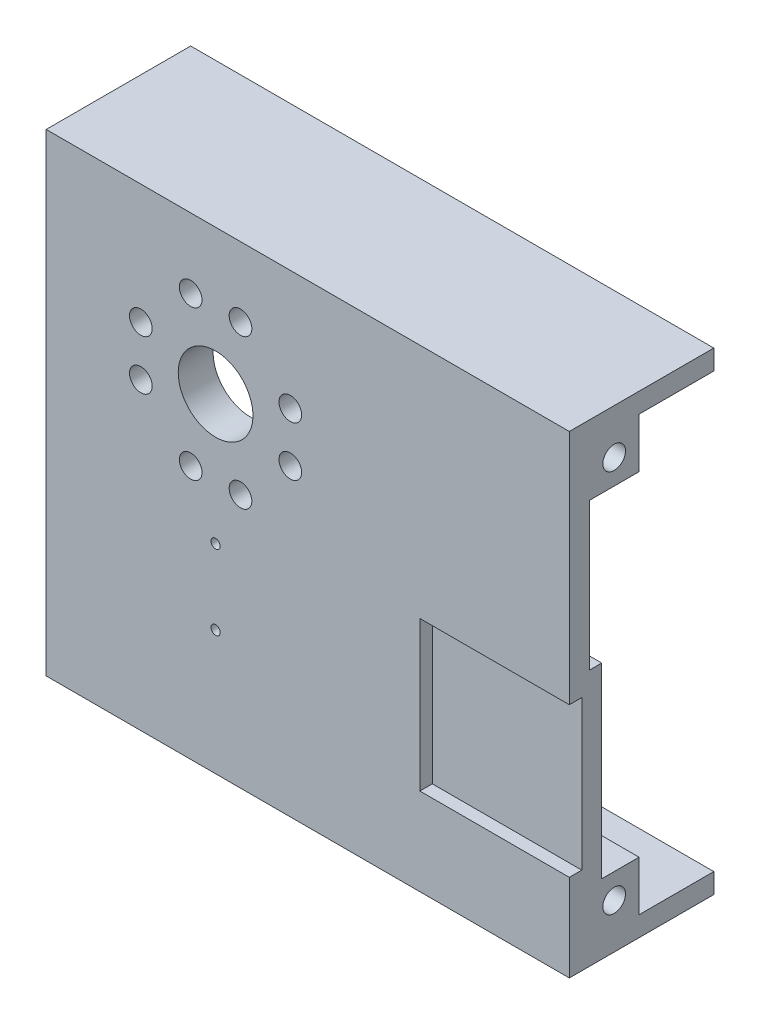
from build123d import *

# Parameters (mm, degrees)
SKETCH_1_W               = 210
SKETCH_1_H               = 190
EXTRUDE_1_DEPTH          = 8
EXTRUDE_2_DEPTH          = 50
SKETCH_3_W               = 20
SKETCH_3_H               = 20
EXTRUDE_3_DEPTH          = 15
SKETCH_8_R               = 4.55
CUT_EXTRUDE_1_DEPTH      = 25
SKETCH_9_W               = 120
SKETCH_9_H               = 100
EXTRUDE_4_DEPTH          = 12
SKETCH_10_R              = 15
CUT_EXTRUDE_2_DEPTH      = 147.608321728
SKETCH_13_R              = 4.55
CUT_EXTRUDE_3_DEPTH      = 154.016338997
PATTERN_CIRCULAR_2_COUNT = 4
SKETCH_14_W              = 120
SKETCH_14_H              = 100
CUT_EXTRUDE_4_DEPTH      = 6
SKETCH_15_R              = 1.85
CUT_EXTRUDE_5_DEPTH      = 10
SKETCH_16_W              = 68
SKETCH_16_H              = 76
EXTRUDE_5_DEPTH          = 13
SKETCH_17_W              = 60
SKETCH_17_H              = 60
CUT_EXTRUDE_6_DEPTH      = 5


with BuildPart() as part:
    # 스케치1 → 보스-돌출1 (new body)
    with BuildSketch(Plane.XY):
        Rectangle(SKETCH_1_W, SKETCH_1_H)
    extrude(amount=EXTRUDE_1_DEPTH)

    # 스케치2 → 보스-돌출2 (add)
    with BuildSketch(Plane(origin=(0, 0, 0), x_dir=(-1, 0, 0), z_dir=(0, 0, -1))):
        Polygon((-105, 95), (105, 95), (105, -95), (-105, -95), (-105, -87), (97, -87), (97, 87), (-105, 87), align=None)
    extrude(amount=EXTRUDE_2_DEPTH)

    # 스케치3 → 보스-돌출3 (add)
    with BuildSketch(Plane(origin=(105, 0, 0), x_dir=(0, 0, -1), z_dir=(1, 0, 0))):
        with Locations((10, 77)):
            Rectangle(SKETCH_3_W, SKETCH_3_H)
    extrude_3 = extrude(amount=-EXTRUDE_3_DEPTH)

    # 스케치8 → 컷-돌출1 (cut)
    with BuildSketch(Plane(origin=(105, 0, 0), x_dir=(0, 0, -1), z_dir=(1, 0, 0))):
        with Locations(Location((10, 77, 0), (0, 0, 90))):
            Circle(SKETCH_8_R)
    cut_extrude_1 = extrude(amount=-CUT_EXTRUDE_1_DEPTH, mode=Mode.SUBTRACT)

    # 대칭 복사1: 보스-돌출3, 컷-돌출1 across plane
    add(extrude_3.mirror(Plane(origin=(0, 0, 0), x_dir=(0, 0, 1), z_dir=(0, -1, 0))))
    add(cut_extrude_1.mirror(Plane(origin=(0, 0, 0), x_dir=(0, 0, 1), z_dir=(0, -1, 0))), mode=Mode.SUBTRACT)

    # 스케치9 → 보스-돌출4 (add)
    with BuildSketch(Plane(origin=(0, 0, 0), x_dir=(-1, 0, 0), z_dir=(0, 0, -1))):
        with Locations((37, 37)):
            Rectangle(SKETCH_9_W, SKETCH_9_H)
    extrude(amount=EXTRUDE_4_DEPTH)

    # 스케치10 → 컷-돌출2 (cut, through all)
    with BuildSketch(Plane(origin=(0, 0, -12), x_dir=(-1, 0, 0), z_dir=(0, 0, -1))):
        with Locations((37, 37)):
            Circle(SKETCH_10_R)
    extrude(amount=-CUT_EXTRUDE_2_DEPTH, mode=Mode.SUBTRACT)

    # 스케치13 → 컷-돌출3 (cut, through all)
    with BuildSketch(Plane.XY.offset(8)):
        with Locations((-47, 67)):
            Circle(SKETCH_13_R)
        with Locations((-27, 67)):
            Circle(SKETCH_13_R)
    cut_extrude_3 = extrude(amount=-CUT_EXTRUDE_3_DEPTH, mode=Mode.SUBTRACT)

    # 원형 패턴2: 컷-돌출3 ×4 about axis
    pattern_circular_2_axis = Axis((-37, 37, 0), (0, 0, 1))
    for i in range(1, PATTERN_CIRCULAR_2_COUNT):
        add(cut_extrude_3.rotate(pattern_circular_2_axis, i * 360 / PATTERN_CIRCULAR_2_COUNT), mode=Mode.SUBTRACT)

    # 스케치14 → 컷-돌출4 (cut)
    with BuildSketch(Plane(origin=(0, 0, -12), x_dir=(-1, 0, 0), z_dir=(0, 0, -1))):
        with Locations((37, 37)):
            Rectangle(SKETCH_14_W, SKETCH_14_H)
    extrude(amount=-CUT_EXTRUDE_4_DEPTH, mode=Mode.SUBTRACT)

    # 스케치15 → 컷-돌출5 (cut)
    with BuildSketch(Plane.XY.offset(8)):
        with Locations((-37, -45)):
            Circle(SKETCH_15_R)
        with Locations((-37, -15)):
            Circle(SKETCH_15_R)
    extrude(amount=-CUT_EXTRUDE_5_DEPTH, mode=Mode.SUBTRACT)

    # 스케치16 → 보스-돌출5 (add)
    with BuildSketch(Plane.XY.offset(8)):
        with Locations((71, -30)):
            Rectangle(SKETCH_16_W, SKETCH_16_H)
    extrude(amount=-EXTRUDE_5_DEPTH)

    # 스케치17 → 컷-돌출6 (cut)
    with BuildSketch(Plane.XY.offset(8)):
        with Locations((75, -30)):
            Rectangle(SKETCH_17_W, SKETCH_17_H)
    extrude(amount=-CUT_EXTRUDE_6_DEPTH, mode=Mode.SUBTRACT)


solid = part.part
